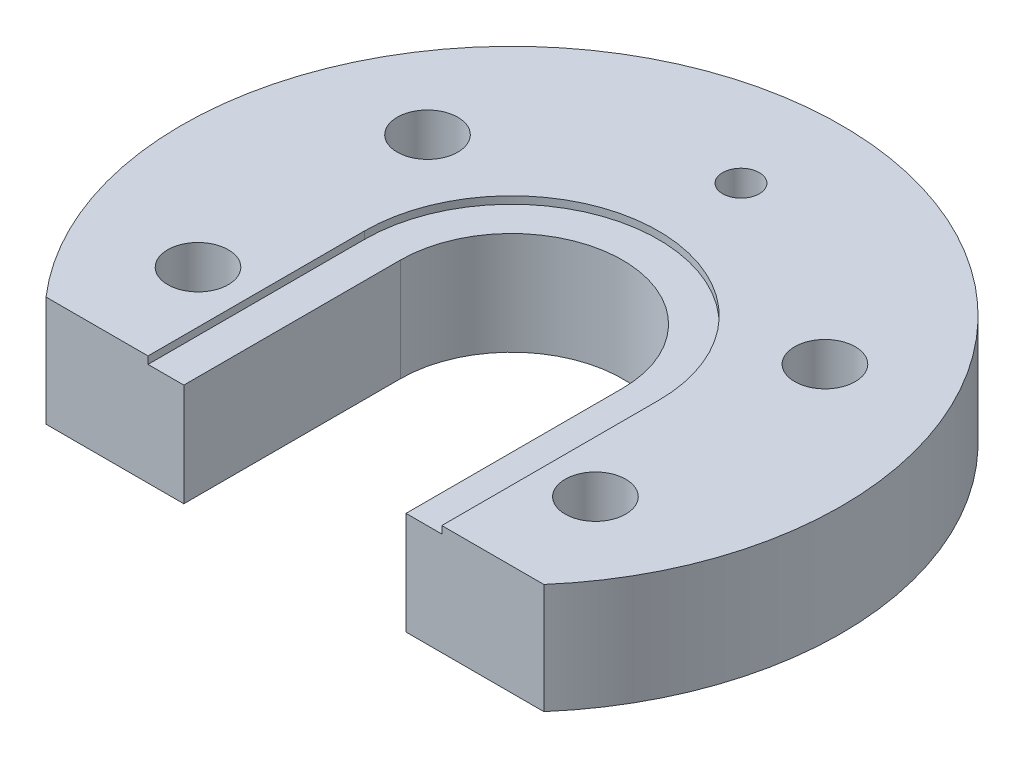
from build123d import *

# Parameters (mm, degrees)
SKETCH1_R           = 1.65
SKETCH1_R_2         = 1
BOSS_EXTRUDE1_DEPTH = 6
CUT_EXTRUDE1_DEPTH  = 0.4


with BuildPart() as part:
    # Sketch1 → Boss-Extrude1 (new body)
    with BuildSketch(Plane(origin=(0, 0, 0), x_dir=(1, 0, 0), z_dir=(0, 1, 0))):
        with BuildLine():
            Line((13.55616119, -11.79495), (6.05, -11.79495))
            Line((6.05, -11.79495), (6.05, 0))
            ThreePointArc((6.05, 0), (0, 6.05), (-6.05, 0))
            Line((-6.05, 0), (-6.05, -11.79495))
            Line((-6.05, -11.79495), (-13.55616119, -11.79495))
            ThreePointArc((-13.55616119, -11.79495), (0, 17.96915), (13.55616119, -11.79495))
        make_face()
        with Locations(Location((-10.82295, 6.24955, 0), (0, 0, 270))):
            Circle(SKETCH1_R, mode=Mode.SUBTRACT)
        with Locations(Location((10.82295, 6.24955, 0), (0, 0, 270))):
            Circle(SKETCH1_R, mode=Mode.SUBTRACT)
        with Locations(Location((10.82295, -6.24955, 0), (0, 0, 270))):
            Circle(SKETCH1_R, mode=Mode.SUBTRACT)
        with Locations(Location((-10.82295, -6.24955, 0), (0, 0, 270))):
            Circle(SKETCH1_R, mode=Mode.SUBTRACT)
        with Locations(Location((0, 12.4985, 0), (0, 0, 270))):
            Circle(SKETCH1_R_2, mode=Mode.SUBTRACT)
    extrude(amount=BOSS_EXTRUDE1_DEPTH)

    # Sketch2 → Cut-Extrude1 (cut)
    with BuildSketch(Plane(origin=(0, 6, 0), x_dir=(1, 0, 0), z_dir=(0, 1, 0))):
        with BuildLine():
            Line((-8, 0), (-8, -11.79495))
            Line((-8, -11.79495), (8, -11.79495))
            Line((8, -11.79495), (8, 0))
            ThreePointArc((8, 0), (0, 8), (-8, 0))
        make_face()
    extrude(amount=-CUT_EXTRUDE1_DEPTH, mode=Mode.SUBTRACT)


solid = part.part
